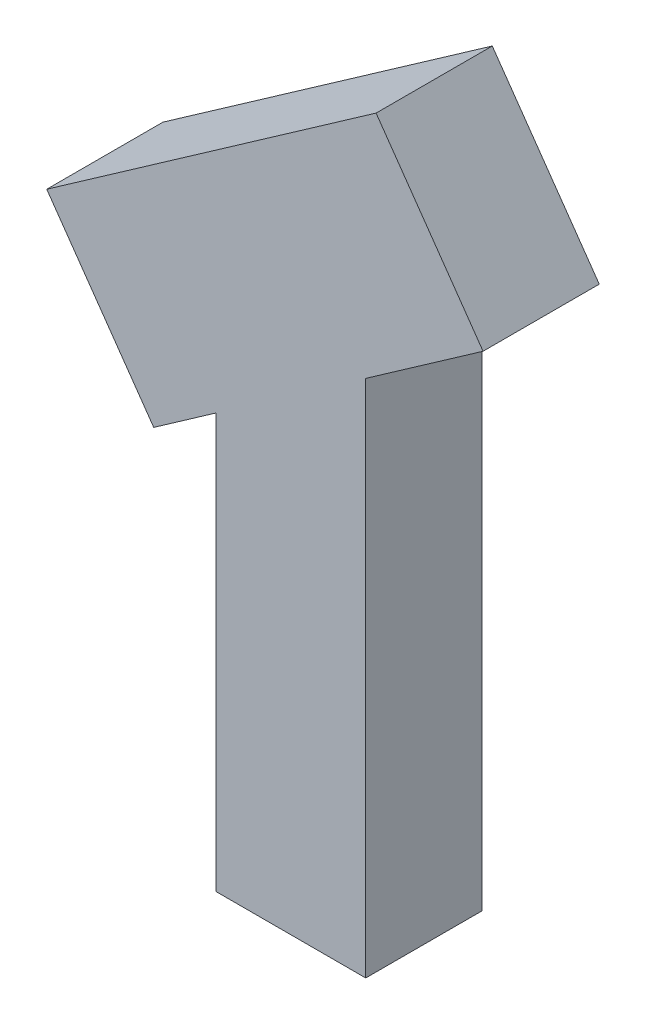
from build123d import *

# Parameters (mm, degrees)
SALIENTE_EXTRUIR1_DEPTH = 38
CORTAR_EXTRUIR4_START   = -38
CORTAR_EXTRUIR4_DEPTH   = 11


with BuildPart() as part:
    # Croquis1 → Saliente-Extruir1 (new, symmetric)
    with BuildSketch(Plane.XY):
        Polygon((-1.079549163, -361), (61.920450837, -361), (61.920450837, -21.313279486), (138.671836045, 32.428619004), (68.69551081, 132.365168408), (-146.741476838, -18.485434353), (-76.765151603, -118.421983756), (-36.079549163, -89.933618231), (-36.079549163, -361), align=None)
    extrude(amount=SALIENTE_EXTRUIR1_DEPTH, both=True)

    # Croquis2 → Cortar-Extruir4 (cut, symmetric)
    with BuildSketch(Plane.XY.offset(CORTAR_EXTRUIR4_START)):
        Polygon((-101.068225195, -26.179853393), (-68.374368323, -72.871519917), (92.998584402, 40.123038044), (60.30472753, 86.814704569), align=None)
    extrude(amount=CORTAR_EXTRUIR4_DEPTH, both=True, mode=Mode.SUBTRACT)


solid = part.part
